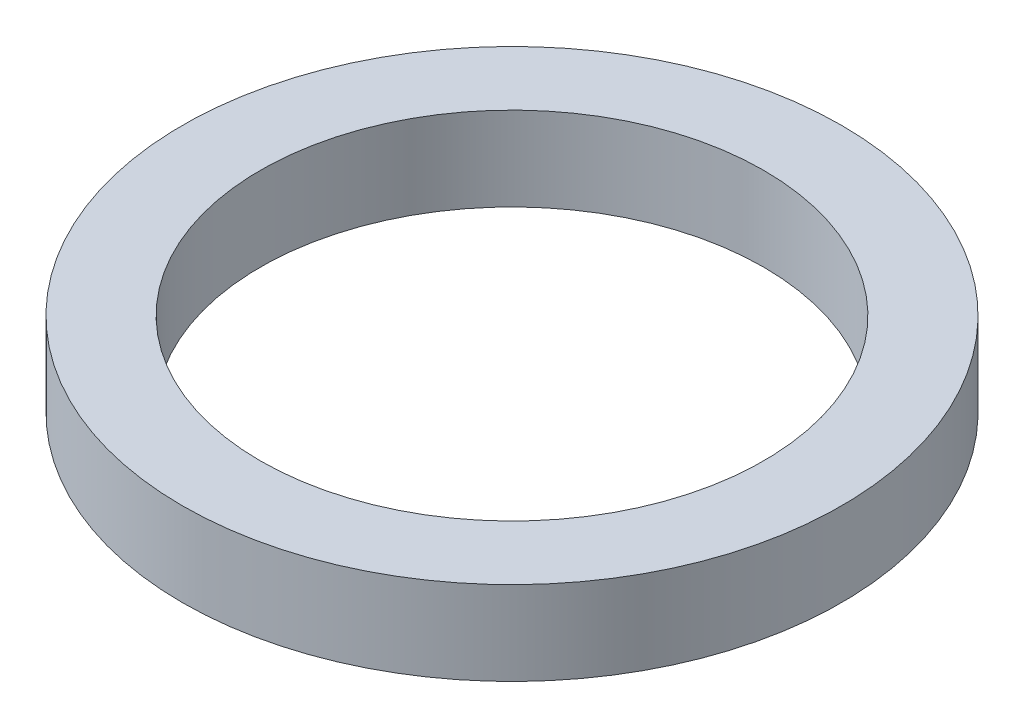
from build123d import *

# Parameters (mm, degrees)
SKETCH_1_R      = 2.75
SKETCH_1_R_2    = 2.1
EXTRUDE_1_DEPTH = 0.7


with BuildPart() as part:
    # Эскиз1 → Бобышка-Вытянуть1 (new body)
    with BuildSketch(Plane(origin=(0, 0, 0), x_dir=(1, 0, 0), z_dir=(0, 1, 0))):
        with Locations(Location((0, 0, 0), (0, 0, 270))):
            Circle(SKETCH_1_R)
        with Locations(Location((0, 0, 0), (0, 0, 270))):
            Circle(SKETCH_1_R_2, mode=Mode.SUBTRACT)
    extrude(amount=EXTRUDE_1_DEPTH)


solid = part.part
